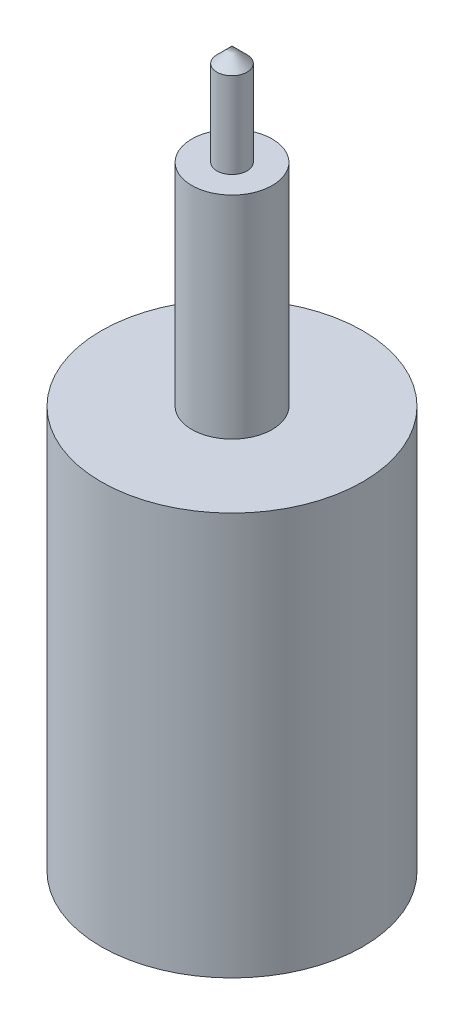
from build123d import *

# Parameters (mm, degrees)
SKETCH2_R           = 26
BOSS_EXTRUDE1_DEPTH = 80
SKETCH3_R           = 8
BOSS_EXTRUDE2_DEPTH = 42
SKETCH4_R           = 3
BOSS_EXTRUDE3_DEPTH = 20
CHAMFER1_SIZE       = 3


with BuildPart() as part:
    # Sketch2 → Boss-Extrude1 (new body)
    with BuildSketch(Plane(origin=(0, 0, 0), x_dir=(1, 0, 0), z_dir=(0, 1, 0))):
        with Locations(Location((0, 0, 0), (0, 0, 270))):
            Circle(SKETCH2_R)
    extrude(amount=BOSS_EXTRUDE1_DEPTH)

    # Sketch3 → Boss-Extrude2 (add)
    with BuildSketch(Plane(origin=(0, 80, 0), x_dir=(1, 0, 0), z_dir=(0, 1, 0))):
        with Locations(Location((0, 0, 0), (0, 0, 90))):
            Circle(SKETCH3_R)
    extrude(amount=BOSS_EXTRUDE2_DEPTH)

    # Sketch4 → Boss-Extrude3 (add)
    with BuildSketch(Plane(origin=(0, 122, 0), x_dir=(1, 0, 0), z_dir=(0, 1, 0))):
        with Locations(Location((0, 0, 0), (0, 0, 270))):
            Circle(SKETCH4_R)
    extrude(amount=BOSS_EXTRUDE3_DEPTH)

    # Chamfer1
    chamfer1_edges = [part.edges().sort_by_distance(p)[0] for p in [
        (0, 142, -3),
    ]]
    chamfer(chamfer1_edges, length=CHAMFER1_SIZE)


solid = part.part
